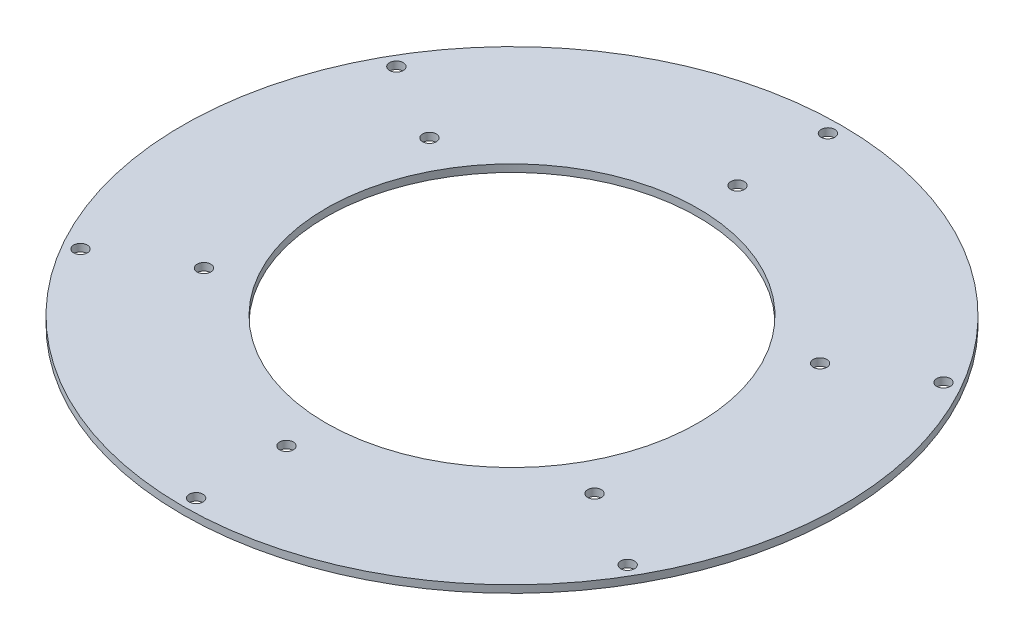
from build123d import *

# Parameters (mm, degrees)
SKETCH1_R           = 70.8759
SKETCH1_R_2         = 1.4732
SKETCH1_R_3         = 40
BOSS_EXTRUDE1_DEPTH = 1.6
SKETCH1_3_R         = 65
SKETCH1_3_R_2       = 57
CUT_EXTRUDE1_DEPTH  = 0.1


with BuildPart() as part:
    # Sketch1 → Boss-Extrude1 (new body)
    with BuildSketch(Plane(origin=(0, 0, 0), x_dir=(1, 0, 0), z_dir=(0, 1, 0))):
        Circle(SKETCH1_R)
        with Locations((-58.835990581, -33.968975)):
            Circle(SKETCH1_R_2, mode=Mode.SUBTRACT)
        with Locations((0, -67.93795)):
            Circle(SKETCH1_R_2, mode=Mode.SUBTRACT)
        with Locations((58.835990581, -33.968975)):
            Circle(SKETCH1_R_2, mode=Mode.SUBTRACT)
        with Locations((-58.835990581, 33.968975)):
            Circle(SKETCH1_R_2, mode=Mode.SUBTRACT)
        with Locations((0, 67.93795)):
            Circle(SKETCH1_R_2, mode=Mode.SUBTRACT)
        with Locations((58.835990581, 33.968975)):
            Circle(SKETCH1_R_2, mode=Mode.SUBTRACT)
        with Locations((0, 48.5)):
            Circle(SKETCH1_R_2, mode=Mode.SUBTRACT)
        with Locations((-42.002232084, -24.25)):
            Circle(SKETCH1_R_2, mode=Mode.SUBTRACT)
        with Locations((0, -48.5)):
            Circle(SKETCH1_R_2, mode=Mode.SUBTRACT)
        with Locations((42.002232084, -24.25)):
            Circle(SKETCH1_R_2, mode=Mode.SUBTRACT)
        with Locations((-42.002232084, 24.25)):
            Circle(SKETCH1_R_2, mode=Mode.SUBTRACT)
        Circle(SKETCH1_R_3, mode=Mode.SUBTRACT)
        with Locations((42.002232084, 24.25)):
            Circle(SKETCH1_R_2, mode=Mode.SUBTRACT)
    extrude(amount=BOSS_EXTRUDE1_DEPTH)

    # Sketch1<3> → Cut-Extrude1 (cut)
    with BuildSketch(Plane(origin=(0, 0, 0), x_dir=(1, 0, 0), z_dir=(0, 1, 0))):
        Circle(SKETCH1_3_R)
        Circle(SKETCH1_3_R_2, mode=Mode.SUBTRACT)
    extrude(amount=CUT_EXTRUDE1_DEPTH, mode=Mode.SUBTRACT)


solid = part.part
